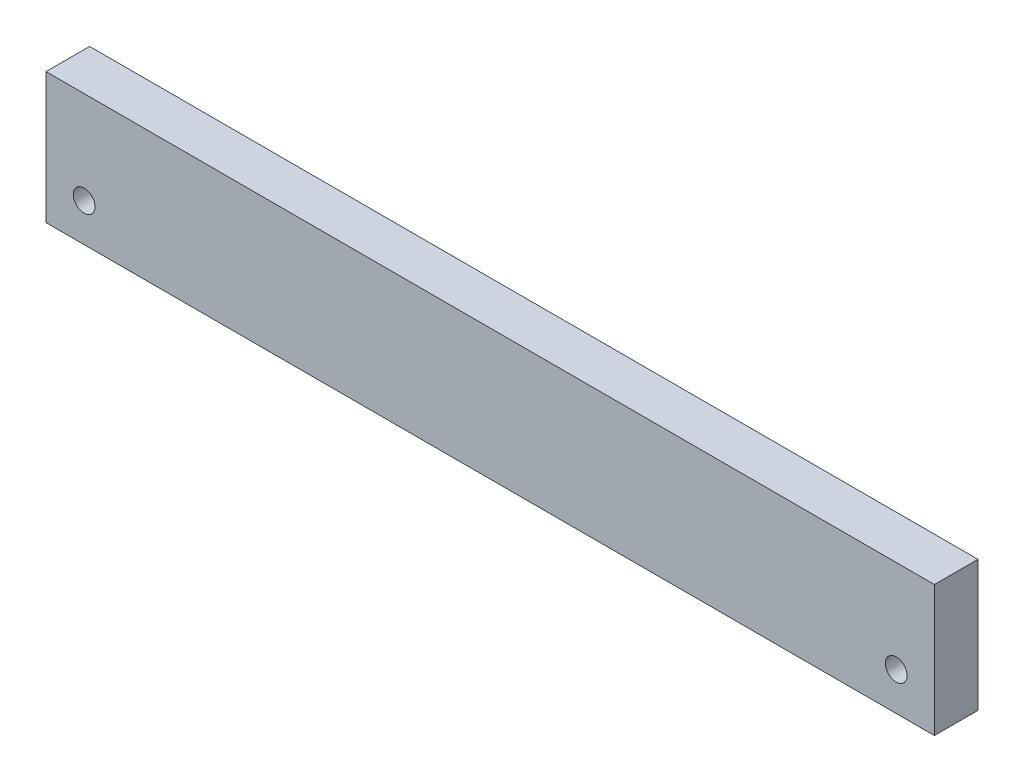
from build123d import *

# Parameters (mm, degrees)
SKETCH1_W           = 81.5
SKETCH1_H           = 12
SKETCH1_R           = 1
BOSS_EXTRUDE1_DEPTH = 4


with BuildPart() as part:
    # Sketch1 → Boss-Extrude1 (new body)
    with BuildSketch(Plane.XY):
        Rectangle(SKETCH1_W, SKETCH1_H)
        with Locations((-37.25, -2.5)):
            Circle(SKETCH1_R, mode=Mode.SUBTRACT)
        with Locations(Location((37.25, -2.5, 0), (0, 0, 180))):
            Circle(SKETCH1_R, mode=Mode.SUBTRACT)
    extrude(amount=BOSS_EXTRUDE1_DEPTH)


solid = part.part
